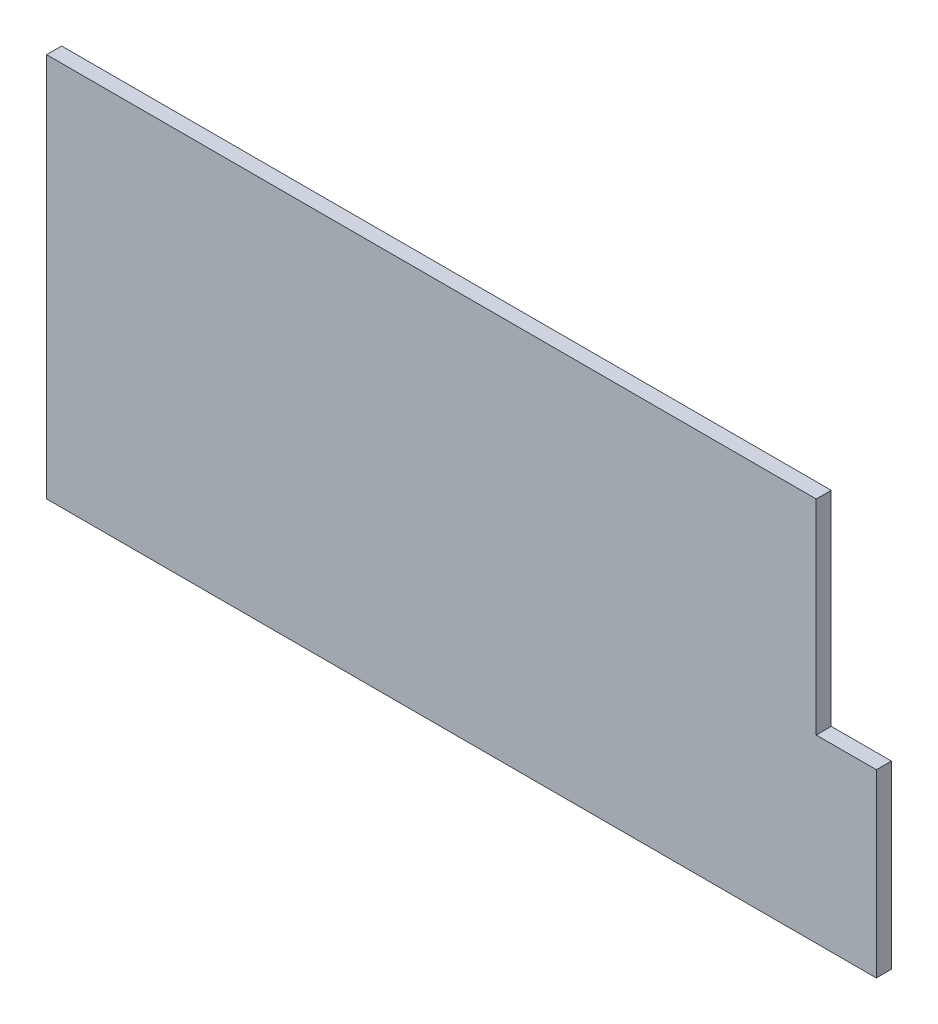
from build123d import *

# Parameters (mm, degrees)
BOSS_EXTRU_1_DEPTH = 5


with BuildPart() as part:
    # Esquisse1 → Boss.-Extru.1 (new body)
    with BuildSketch(Plane.XY):
        Polygon((0, 0), (276, 0), (276, 60), (256, 60), (256, 128), (0, 128), align=None)
    extrude(amount=BOSS_EXTRU_1_DEPTH)


solid = part.part
